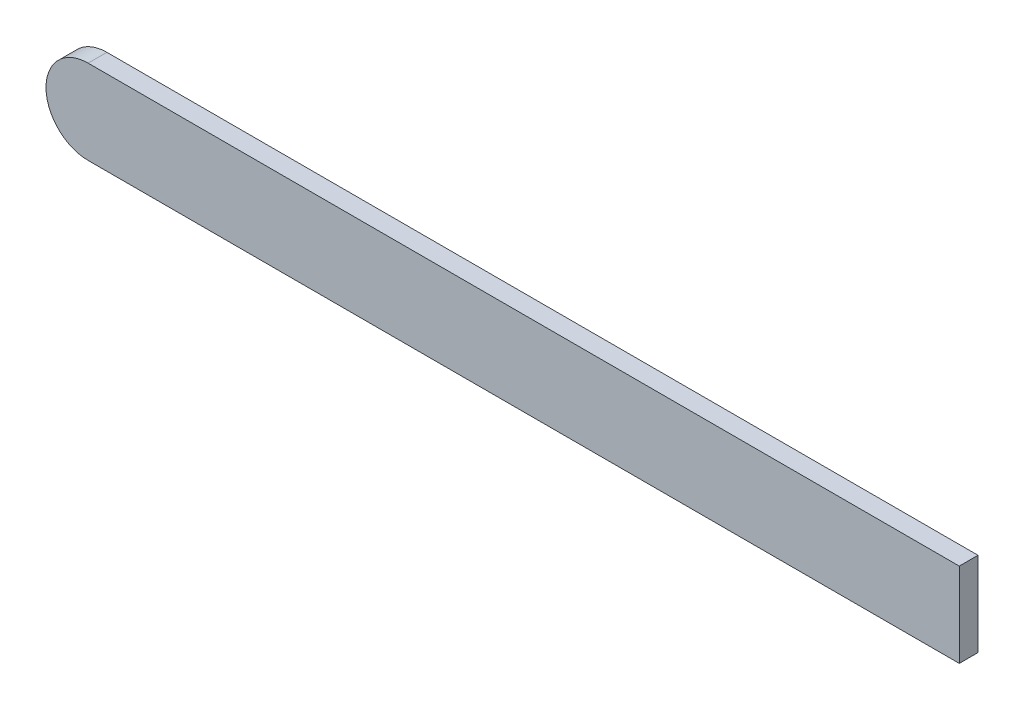
from build123d import *

# Parameters (mm, degrees)
BOSS_EXTRUDE1_DEPTH = 2.116666667


with BuildPart() as part:
    # Sketch1 → Boss-Extrude1 (new body)
    with BuildSketch(Plane.XY):
        with BuildLine():
            Line((-44.45, 4.7625), (53.975, 4.7625))
            Line((53.975, 4.7625), (53.975, -4.7625))
            Line((53.975, -4.7625), (-44.45, -4.7625))
            ThreePointArc((-44.45, -4.7625), (-49.2125, 0), (-44.45, 4.7625))
        make_face()
    extrude(amount=BOSS_EXTRUDE1_DEPTH)


solid = part.part
